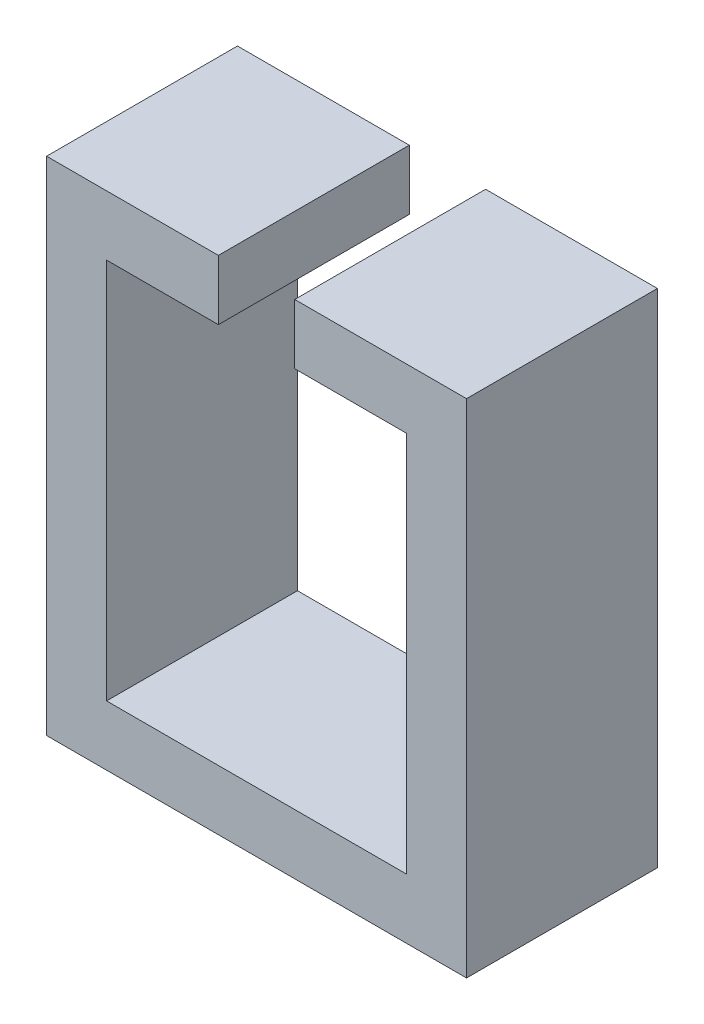
from build123d import *

# Parameters (mm, degrees)
EXTRUDE_1_DEPTH = 3.5


with BuildPart() as part:
    # 스케치1 → 보스-돌출1 (new body)
    with BuildSketch(Plane.XY):
        Polygon((0.7, 3.5), (2.75, 3.5), (2.75, -3.5), (-2.75, -3.5), (-2.75, 3.5), (-0.7, 3.5), (-0.7, 4.6), (-3.85, 4.6), (-3.85, -4.6), (3.85, -4.6), (3.85, 4.6), (0.7, 4.6), align=None)
    extrude(amount=EXTRUDE_1_DEPTH)


solid = part.part
